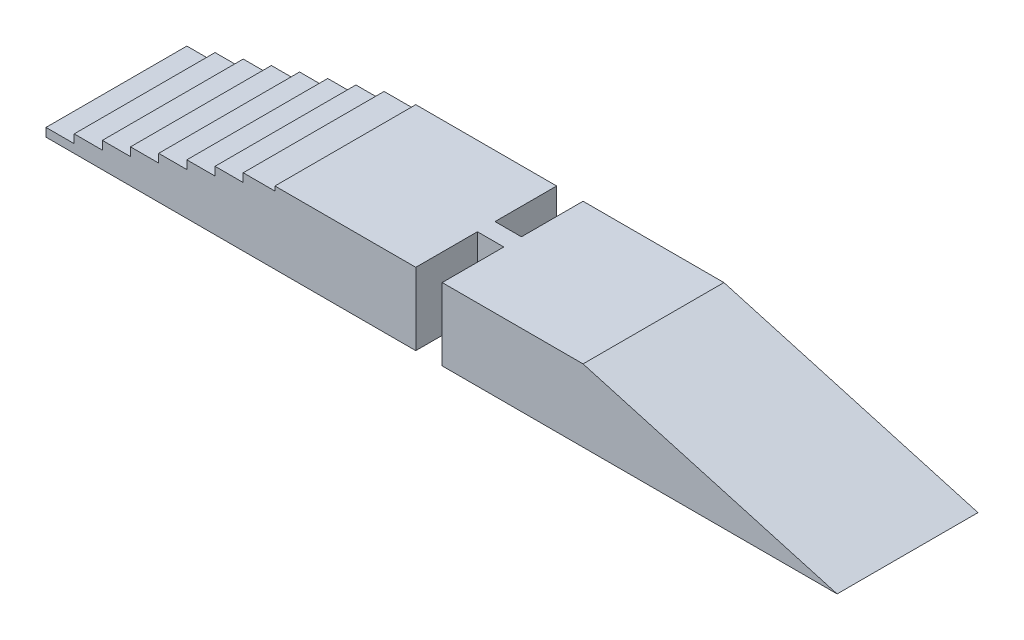
from build123d import *

# Parameters (mm, degrees)
BOSS_EXTRUDE1_DEPTH = 800
SKETCH3_W           = 150
SKETCH3_H           = 350
CUT_EXTRUDE1_DEPTH  = 800


with BuildPart() as part:
    # Sketch1 → Boss-Extrude1 (new body)
    with BuildSketch(Plane.XY):
        Polygon((-1186.898547427, 48.125), (-1026.898547427, 48.125), (-1026.898547427, 96.25), (-866.898547427, 96.25), (-866.898547427, 144.375), (-706.898547427, 144.375), (-706.898547427, 192.5), (-546.898547427, 192.5), (-546.898547427, 240.625), (-386.898547427, 240.625), (-386.898547427, 288.75), (-226.898547427, 288.75), (-226.898547427, 336.875), (-66.898547427, 336.875), (-66.898547427, 385), (113.101452573, 385), (113.101452573, 410), (913.101452573, 410), (1063.101452573, 410), (1863.101452573, 410), (3305.980518884, 0), (-1186.898547427, 0), align=None)
    extrude(amount=BOSS_EXTRUDE1_DEPTH)

    # Sketch3 → Cut-Extrude1 (cut)
    with BuildSketch(Plane(origin=(0, 410, 0), x_dir=(1, 0, 0), z_dir=(0, 1, 0))):
        with Locations((988.101452573, -175)):
            Rectangle(SKETCH3_W, SKETCH3_H)
        with Locations((988.101452573, -625)):
            Rectangle(SKETCH3_W, SKETCH3_H)
    extrude(amount=-CUT_EXTRUDE1_DEPTH, mode=Mode.SUBTRACT)


solid = part.part
